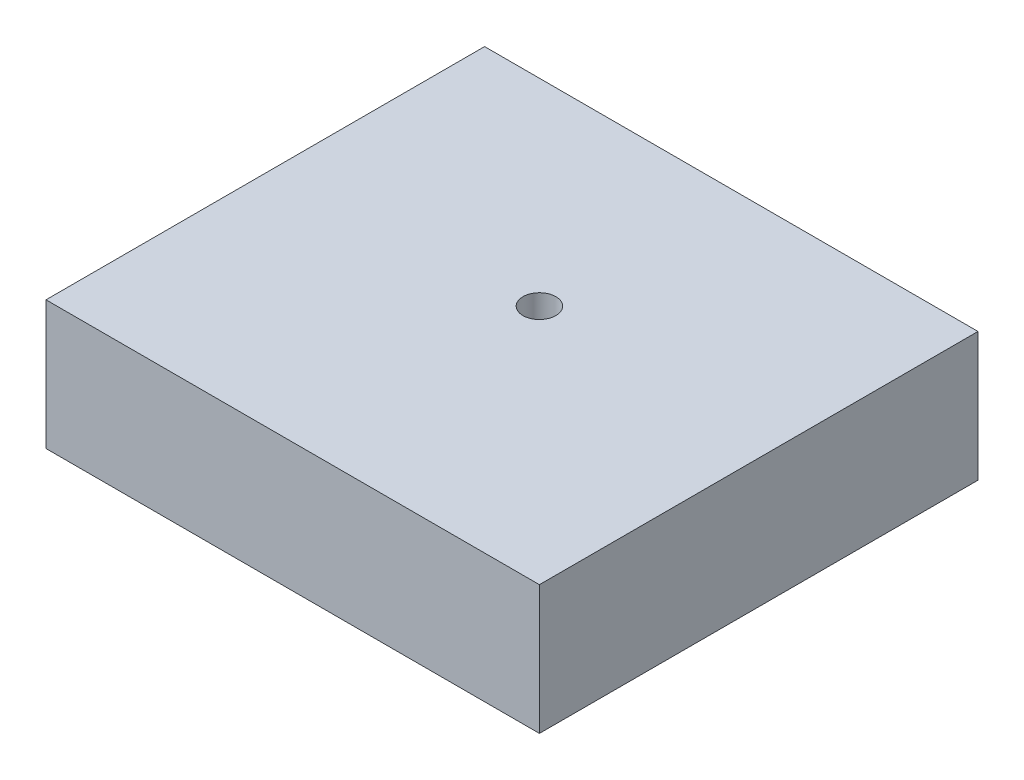
from build123d import *

# Parameters (mm, degrees)
SKETCH1_W           = 18
SKETCH1_H           = 16
SKETCH1_R           = 0.6
BOSS_EXTRUDE1_DEPTH = 4.7


with BuildPart() as part:
    # Sketch1 → Boss-Extrude1 (new body)
    with BuildSketch(Plane(origin=(0, 0, 0), x_dir=(1, 0, 0), z_dir=(0, 1, 0))):
        with Locations((9, 8)):
            Rectangle(SKETCH1_W, SKETCH1_H)
        with Locations(Location((9.2, 8.8, 0), (0, 0, 270))):
            Circle(SKETCH1_R, mode=Mode.SUBTRACT)
    extrude(amount=BOSS_EXTRUDE1_DEPTH)


solid = part.part
